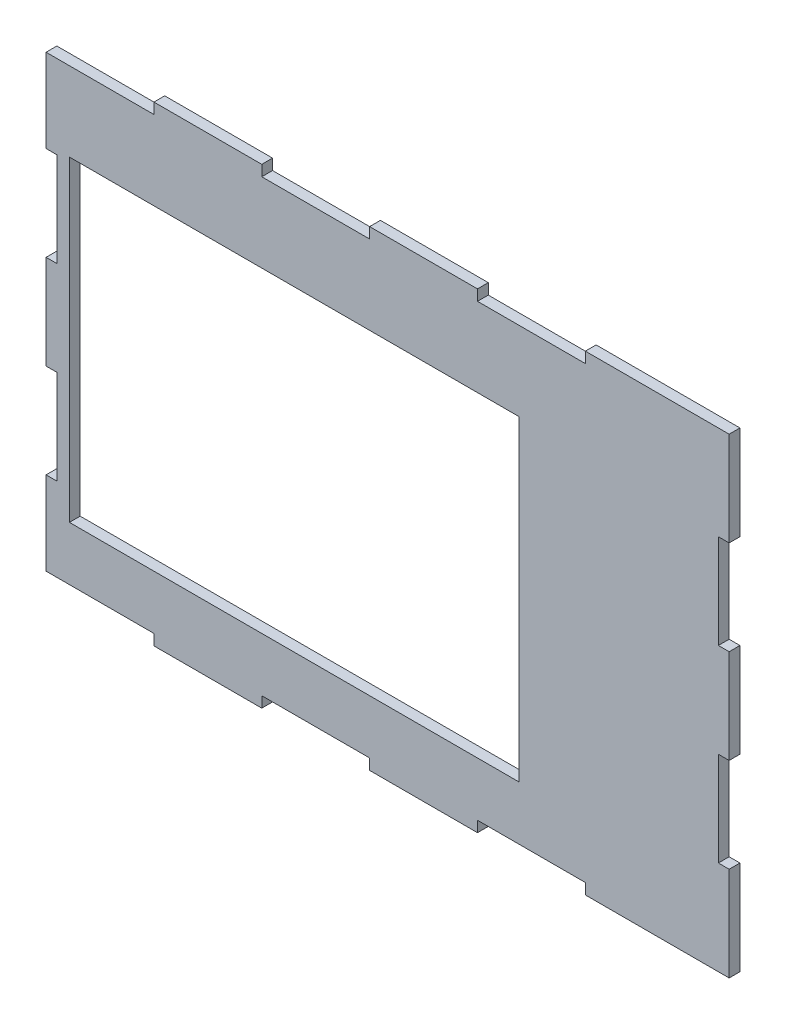
from build123d import *

# Parameters (mm, degrees)
SKETCH1_W           = 125
SKETCH1_H           = 88
BOSS_EXTRUDE1_DEPTH = 3


with BuildPart() as part:
    # Sketch1 → Boss-Extrude1 (new body)
    with BuildSketch(Plane.XY):
        Polygon((60, 128), (60, 131), (30, 131), (30, 128), (0, 128), (0, 104.8), (3, 104.8), (3, 78.6), (0, 78.6), (0, 52.4), (3, 52.4), (3, 26.2), (0, 26.2), (0, 3), (30, 3), (30, 0), (60, 0), (60, 3), (90, 3), (90, 0), (120, 0), (120, 3), (150, 3), (150, 0), (190, 0), (190, 26.2), (187, 26.2), (187, 52.4), (190, 52.4), (190, 78.6), (187, 78.6), (187, 104.8), (190, 104.8), (190, 131), (150, 131), (150, 128), (120, 128), (120, 131), (90, 131), (90, 128), align=None)
        with Locations((69, 62)):
            Rectangle(SKETCH1_W, SKETCH1_H, mode=Mode.SUBTRACT)
    extrude(amount=BOSS_EXTRUDE1_DEPTH)


solid = part.part
